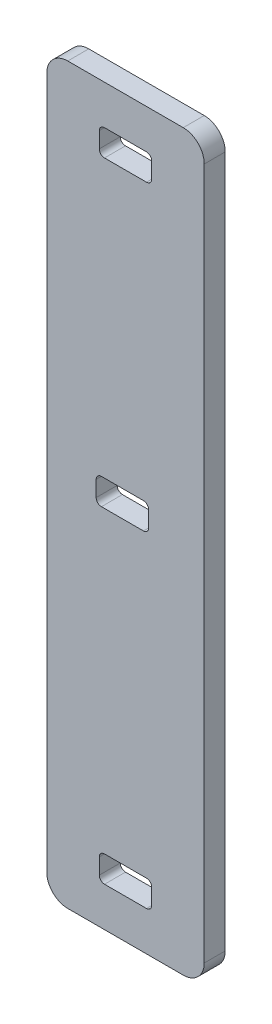
from build123d import *

# Parameters (mm, degrees)
BOSS_EXTRU_1_DEPTH      = 4
ENL_V_MAT_EXTRU_1_DEPTH = 72.617785675


with BuildPart() as part:
    # Esquisse1 → Boss.-Extru.1 (new body)
    with BuildSketch(Plane.XY):
        with BuildLine():
            Line((-11, -69.915), (11, -69.915))
            ThreePointArc((11, -69.915), (13.828427125, -68.743427125), (15, -65.915))
            Line((15, -65.915), (15, 65.915))
            ThreePointArc((15, 65.915), (13.828427125, 68.743427125), (11, 69.915))
            Line((11, 69.915), (-11, 69.915))
            ThreePointArc((-11, 69.915), (-13.828427125, 68.743427125), (-15, 65.915))
            Line((-15, 65.915), (-15, -65.915))
            ThreePointArc((-15, -65.915), (-13.828427125, -68.743427125), (-11, -69.915))
        make_face()
    extrude(amount=BOSS_EXTRU_1_DEPTH)

    # Esquisse2 → Enlèv. mat.-Extru.1 (cut, through all)
    with BuildSketch(Plane.XY.offset(4)):
        with BuildLine():
            Line((-4, -57.415), (4, -57.415))
            ThreePointArc((4, -57.415), (4.707106781, -57.707893219), (5, -58.415))
            Line((5, -58.415), (5, -61.415))
            ThreePointArc((5, -61.415), (4.707106781, -62.122106781), (4, -62.415))
            Line((4, -62.415), (-4, -62.415))
            ThreePointArc((-4, -62.415), (-4.707106781, -62.122106781), (-5, -61.415))
            Line((-5, -61.415), (-5, -58.415))
            ThreePointArc((-5, -58.415), (-4.707106781, -57.707893219), (-4, -57.415))
        make_face()
        with BuildLine():
            Line((-4, 62.415), (4, 62.415))
            ThreePointArc((4, 62.415), (4.707106781, 62.122106781), (5, 61.415))
            Line((5, 61.415), (5, 58.415))
            ThreePointArc((5, 58.415), (4.707106781, 57.707893219), (4, 57.415))
            Line((4, 57.415), (-4, 57.415))
            ThreePointArc((-4, 57.415), (-4.707106781, 57.707893219), (-5, 58.415))
            Line((-5, 58.415), (-5, 61.415))
            ThreePointArc((-5, 61.415), (-4.707106781, 62.122106781), (-4, 62.415))
        make_face()
        with BuildLine():
            Line((-4.587622439, 4.585), (3.412377561, 4.585))
            ThreePointArc((3.412377561, 4.585), (4.119484342, 4.292106781), (4.412377561, 3.585))
            Line((4.412377561, 3.585), (4.412377561, 0.585))
            ThreePointArc((4.412377561, 0.585), (4.119484342, -0.122106781), (3.412377561, -0.415))
            Line((3.412377561, -0.415), (-4.587622439, -0.415))
            ThreePointArc((-4.587622439, -0.415), (-5.29472922, -0.122106781), (-5.587622439, 0.585))
            Line((-5.587622439, 0.585), (-5.587622439, 3.585))
            ThreePointArc((-5.587622439, 3.585), (-5.29472922, 4.292106781), (-4.587622439, 4.585))
        make_face()
    extrude(amount=-ENL_V_MAT_EXTRU_1_DEPTH, mode=Mode.SUBTRACT)


solid = part.part
